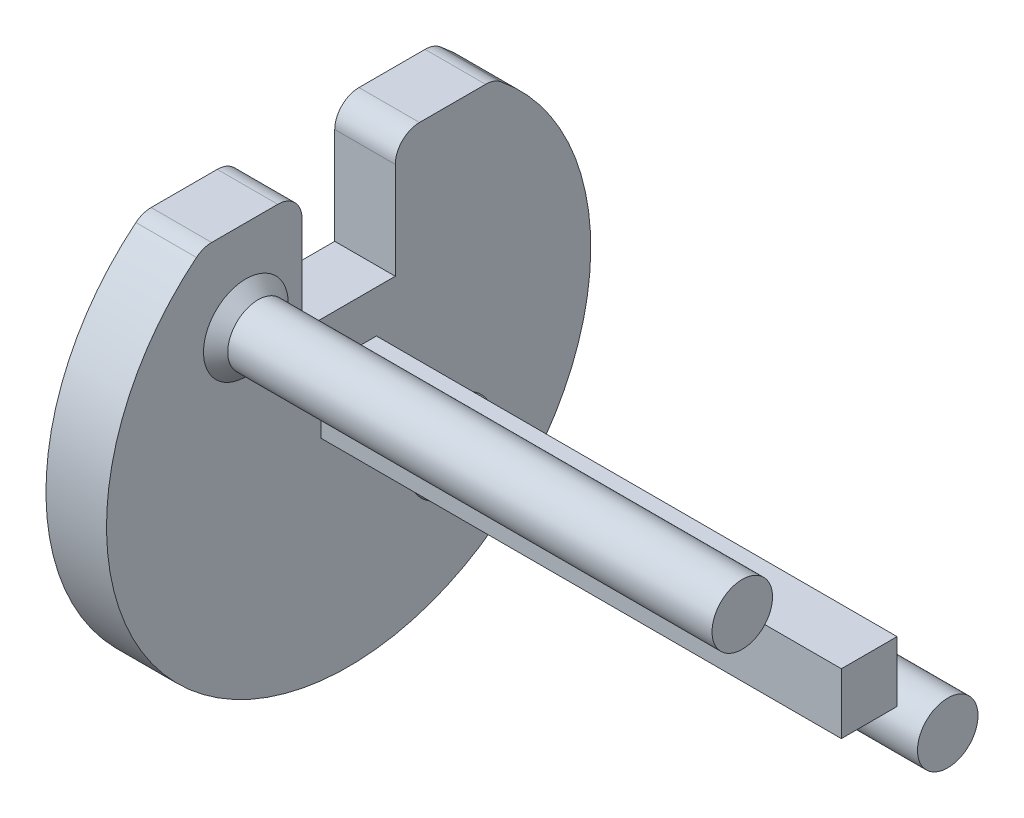
from build123d import *

# Parameters (mm, degrees)
SKETCH2_R           = 20
BOSS_EXTRUDE2_DEPTH = 5
SKETCH3_W           = 5
SKETCH3_H           = 5
BOSS_EXTRUDE3_DEPTH = 43
SKETCH4_R           = 2.5
BOSS_EXTRUDE4_DEPTH = 41
SKETCH5_W           = 7.704684196
SKETCH5_H           = 10
CUT_EXTRUDE1_DEPTH  = 52.46843693
FILLET1_R           = 2
CHAMFER1_SIZE       = 1
SKETCH6_W           = 43
SKETCH6_H           = 5
CUT_EXTRUDE2_DEPTH  = 0.2
SKETCH7_W           = 43
SKETCH7_H           = 5
CUT_EXTRUDE3_DEPTH  = 0.2


with BuildPart() as part:
    # Sketch2 → Boss-Extrude2 (new body)
    with BuildSketch(Plane(origin=(0, 0, 0), x_dir=(0, 0, -1), z_dir=(1, 0, 0))):
        Circle(SKETCH2_R)
    extrude(amount=BOSS_EXTRUDE2_DEPTH)

    # Sketch3 → Boss-Extrude3 (add)
    with BuildSketch(Plane(origin=(5, 0, 0), x_dir=(0, 0, -1), z_dir=(1, 0, 0))):
        Rectangle(SKETCH3_W, SKETCH3_H)
    extrude(amount=BOSS_EXTRUDE3_DEPTH)

    # Sketch4 → Boss-Extrude4 (add)
    with BuildSketch(Plane(origin=(5, 0, 0), x_dir=(0, 0, -1), z_dir=(1, 0, 0))):
        with Locations((-8.485281374, 8.485281374)):
            Circle(SKETCH4_R)
        with Locations((8.485281374, -8.485281374)):
            Circle(SKETCH4_R)
    extrude(amount=BOSS_EXTRUDE4_DEPTH)

    # Sketch5 → Cut-Extrude1 (cut, through all)
    with BuildSketch(Plane(origin=(5, 0, 0), x_dir=(0, 0, -1), z_dir=(1, 0, 0))):
        with BuildLine():
            Line((-12, 16), (-3.852342098, 16))
            Line((-3.852342098, 16), (-3.852342098, 19.625479876))
            ThreePointArc((-3.852342098, 19.625479876), (-8.130818752, 18.272651324), (-12, 16))
        make_face()
        with BuildLine():
            Line((-3.852342098, 19.625479876), (-3.852342098, 16))
            Line((-3.852342098, 16), (3.852342098, 16))
            Line((3.852342098, 16), (3.852342098, 19.625479876))
            ThreePointArc((3.852342098, 19.625479876), (1.935252254, 19.906149771), (2.3e-08, 20))
            ThreePointArc((2.3e-08, 20), (-1.935252231, 19.906149773), (-3.852342098, 19.625479876))
        make_face()
        with BuildLine():
            Line((3.852342098, 19.625479876), (3.852342098, 16))
            Line((3.852342098, 16), (12, 16))
            ThreePointArc((12, 16), (8.130818752, 18.272651324), (3.852342098, 19.625479876))
        make_face()
        with Locations((0, 11)):
            Rectangle(SKETCH5_W, SKETCH5_H)
    extrude(amount=-CUT_EXTRUDE1_DEPTH, mode=Mode.SUBTRACT)

    # Fillet1
    fillet1_edges = [part.edges().sort_by_distance(p)[0] for p in [
        (2.5, 16, 12),
        (2.5, 16, -12),
        (2.5, 16, -3.852342098),
        (2.5, 16, 3.852342098),
    ]]
    fillet(fillet1_edges, radius=FILLET1_R)

    # Chamfer1
    chamfer1_edges = [part.edges().sort_by_distance(p)[0] for p in [
        (5, 8.485281374, 10.985281374),
        (5, -8.485281374, -5.985281374),
    ]]
    chamfer(chamfer1_edges, length=CHAMFER1_SIZE)

    # Sketch6 → Cut-Extrude2 (cut)
    with BuildSketch(Plane(origin=(0, 0, -2.5), x_dir=(-1, 0, 0), z_dir=(0, 0, -1))):
        with Locations((-26.5, 0)):
            Rectangle(SKETCH6_W, SKETCH6_H)
    extrude(amount=-CUT_EXTRUDE2_DEPTH, mode=Mode.SUBTRACT)

    # Sketch7 → Cut-Extrude3 (cut)
    with BuildSketch(Plane.XY.offset(2.5)):
        with Locations((26.5, 0)):
            Rectangle(SKETCH7_W, SKETCH7_H)
    extrude(amount=-CUT_EXTRUDE3_DEPTH, mode=Mode.SUBTRACT)


solid = part.part
